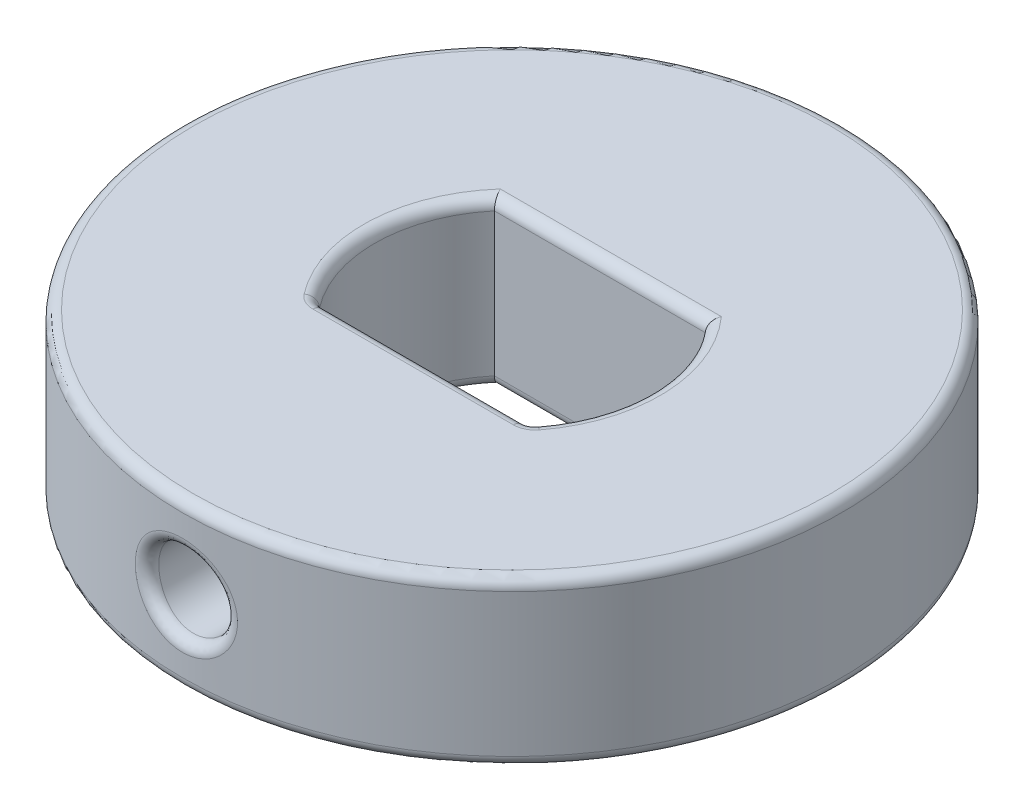
from build123d import *

# Parameters (mm, degrees)
SKETCH2_R           = 30
BOSS_EXTRUDE1_DEPTH = 15
SKETCH4_R           = 3.5
CUT_EXTRUDE1_DEPTH  = 25
FILLET1_R           = 1


with BuildPart() as part:
    # Sketch2 → Boss-Extrude1 (new body)
    with BuildSketch(Plane(origin=(0, 0, 0), x_dir=(1, 0, 0), z_dir=(0, 1, 0))):
        with Locations(Location((35.09152354, 7.5, 0), (0, 0, 270))):
            Circle(SKETCH2_R)
        with BuildLine():
            Line((35.09152354, -0.5), (44.696209896, -0.5))
            ThreePointArc((44.696209896, -0.5), (47.59152354, 7.5), (44.696209896, 15.5))
            Line((44.696209896, 15.5), (35.09152354, 15.5))
            Line((35.09152354, 15.5), (25.486837184, 15.5))
            ThreePointArc((25.486837184, 15.5), (22.59152354, 7.5), (25.486837184, -0.5))
            Line((25.486837184, -0.5), (35.09152354, -0.5))
        make_face(mode=Mode.SUBTRACT)
    extrude(amount=BOSS_EXTRUDE1_DEPTH)

    # Sketch4 → Cut-Extrude1 (cut)
    with BuildSketch(Plane.XY):
        with Locations(Location((35.09152354, 7.5, 0), (0, 0, 180))):
            Circle(SKETCH4_R)
    extrude(amount=CUT_EXTRUDE1_DEPTH, mode=Mode.SUBTRACT)

    # Fillet1
    fillet1_edges = [part.edges().sort_by_distance(p)[0] for p in [
        (35.09152354, 15, 0.5),
        (47.59152354, 15, -7.5),
        (22.59152354, 15, -7.5),
        (35.09152354, 0, -15.5),
        (35.09152354, 0, -37.5),
        (38.59152354, 7.5, 0.5),
        (38.59152354, 7.5, 22.295133831),
        (35.09152354, 15, -37.5),
        (35.09152354, 0, 0.5),
        (25.486837184, 7.5, 0.5),
        (47.59152354, 0, -7.5),
        (44.696209896, 7.5, 0.5),
        (35.09152354, 15, -15.5),
        (22.59152354, 0, -7.5),
    ]]
    fillet(fillet1_edges, radius=FILLET1_R)


solid = part.part
